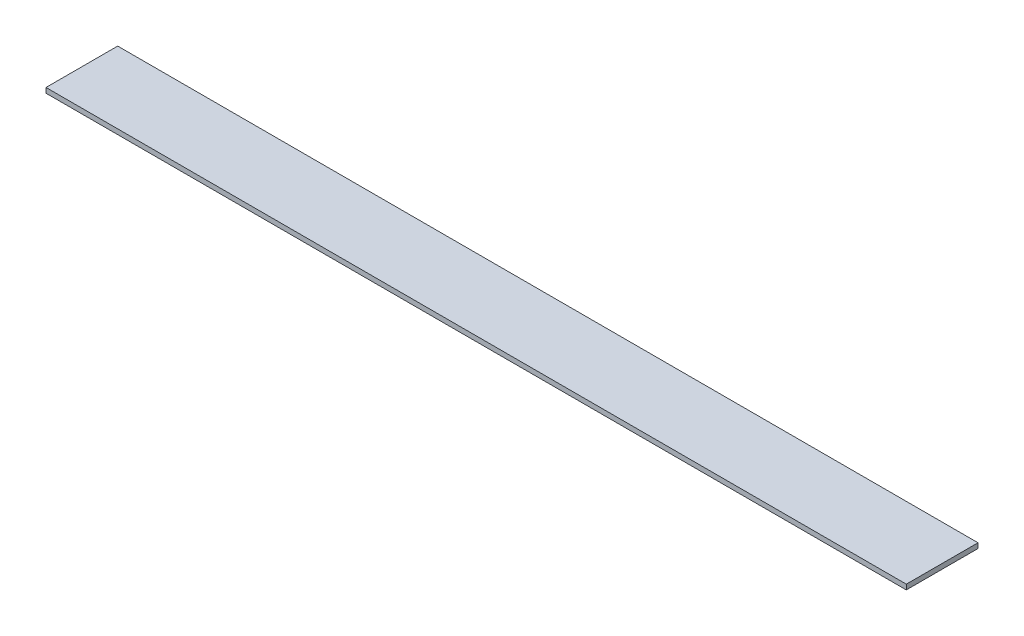
from build123d import *

# Parameters (mm, degrees)
SKETCH1_W           = 120
SKETCH1_H           = 10
BOSS_EXTRUDE1_DEPTH = 0.7


with BuildPart() as part:
    # Sketch1 → Boss-Extrude1 (new body)
    with BuildSketch(Plane(origin=(0, 0, 0), x_dir=(1, 0, 0), z_dir=(0, 1, 0))):
        Rectangle(SKETCH1_W, SKETCH1_H)
    extrude(amount=BOSS_EXTRUDE1_DEPTH)


solid = part.part
